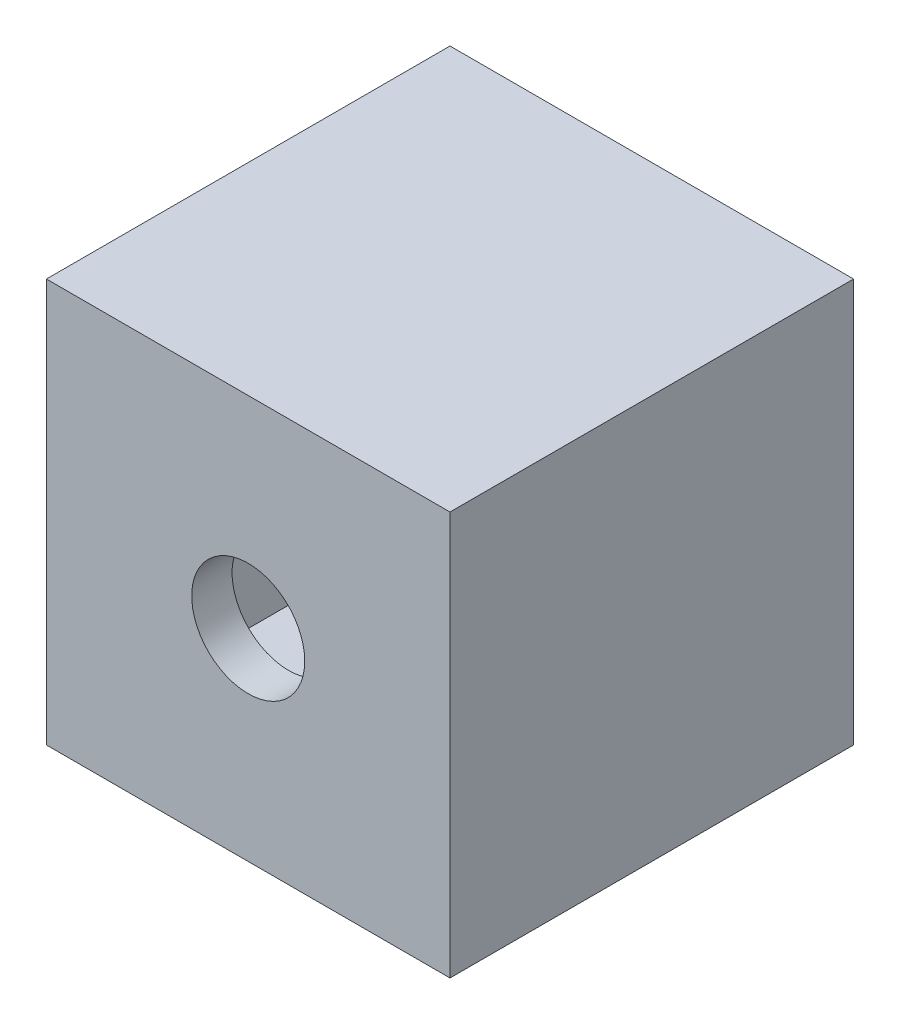
from build123d import *

# Parameters (mm, degrees)
SKETCH5_W           = 200
SKETCH5_H           = 200
BOSS_EXTRUDE2_DEPTH = 200
SHELL2_T            = -20
SKETCH6_R           = 28
CUT_EXTRUDE2_DEPTH  = 51.6


with BuildPart() as part:
    # Sketch5 → Boss-Extrude2 (new body)
    with BuildSketch(Plane.XY):
        Rectangle(SKETCH5_W, SKETCH5_H)
    extrude(amount=BOSS_EXTRUDE2_DEPTH)

    # Shell2
    shell2_openings = [part.faces().sort_by_distance(p)[0] for p in [
        (0, 0, 0),
    ]]
    offset(amount=SHELL2_T, openings=shell2_openings, kind=Kind.INTERSECTION)

    # Sketch6 → Cut-Extrude2 (cut)
    with BuildSketch(Plane.XY.offset(200)):
        Circle(SKETCH6_R)
    extrude(amount=-CUT_EXTRUDE2_DEPTH, mode=Mode.SUBTRACT)


solid = part.part
